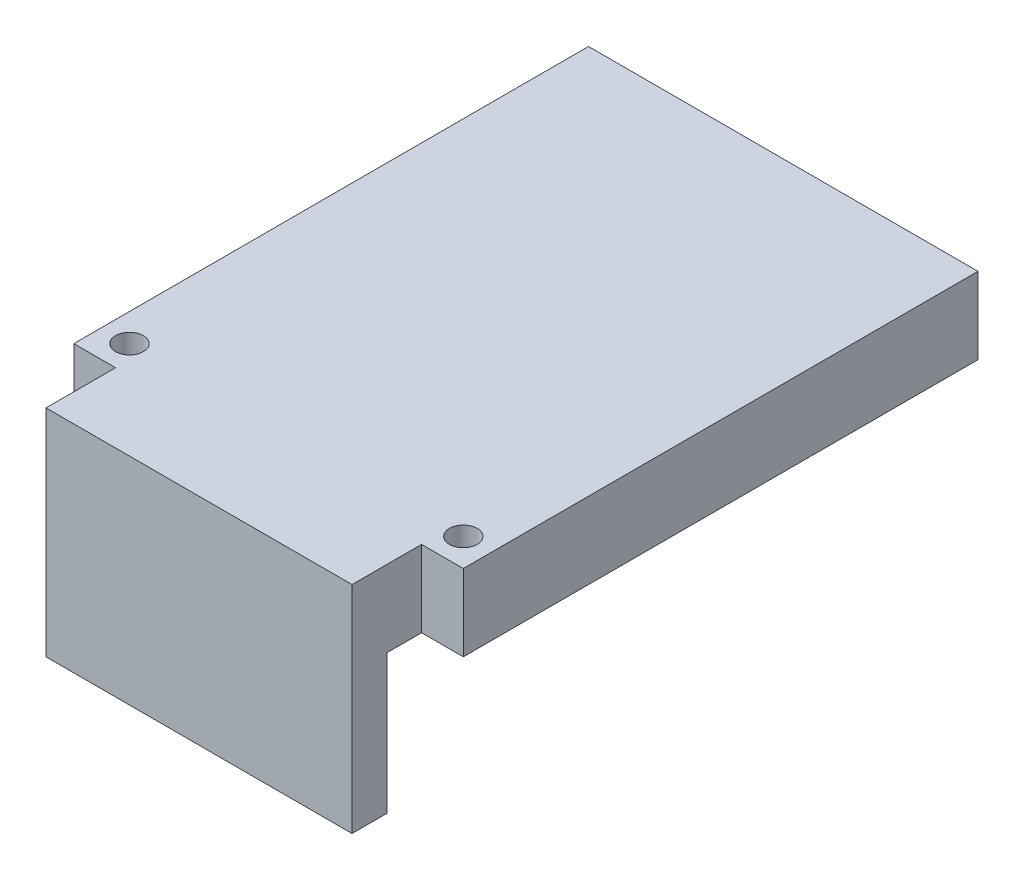
from build123d import *

# Parameters (mm, degrees)
SKETCH2_W           = 28
SKETCH2_H           = 42
BOSS_EXTRUDE1_DEPTH = 5.5
SKETCH3_W           = 3
SKETCH3_H           = 5
CUT_EXTRUDE1_DEPTH  = 5.5
SKETCH4_W           = 22
SKETCH4_H           = 2.5
BOSS_EXTRUDE2_DEPTH = 10
SKETCH5_R           = 1
CUT_EXTRUDE2_DEPTH  = 10


with BuildPart() as part:
    # Sketch2 → Boss-Extrude1 (new body)
    with BuildSketch(Plane(origin=(0, 0, 0), x_dir=(1, 0, 0), z_dir=(0, 1, 0))):
        with Locations((14, 21)):
            Rectangle(SKETCH2_W, SKETCH2_H)
    extrude(amount=BOSS_EXTRUDE1_DEPTH)

    # Sketch3 → Cut-Extrude1 (cut)
    with BuildSketch(Plane(origin=(0, 5.5, 0), x_dir=(1, 0, 0), z_dir=(0, 1, 0))):
        with Locations((1.5, 2.5)):
            Rectangle(SKETCH3_W, SKETCH3_H)
        with Locations((26.5, 2.5)):
            Rectangle(SKETCH3_W, SKETCH3_H)
    extrude(amount=-CUT_EXTRUDE1_DEPTH, mode=Mode.SUBTRACT)

    # Sketch4 → Boss-Extrude2 (add)
    with BuildSketch(Plane.XZ):
        with Locations((14, -1.25)):
            Rectangle(SKETCH4_W, SKETCH4_H)
    extrude(amount=BOSS_EXTRUDE2_DEPTH)

    # Sketch5 → Cut-Extrude2 (cut)
    with BuildSketch(Plane(origin=(0, 5.5, 0), x_dir=(1, 0, 0), z_dir=(0, 1, 0))):
        with Locations(Location((2, 7, 0), (0, 0, 270))):
            Circle(SKETCH5_R)
        with Locations(Location((26, 7, 0), (0, 0, 270))):
            Circle(SKETCH5_R)
    extrude(amount=-CUT_EXTRUDE2_DEPTH, mode=Mode.SUBTRACT)


solid = part.part
